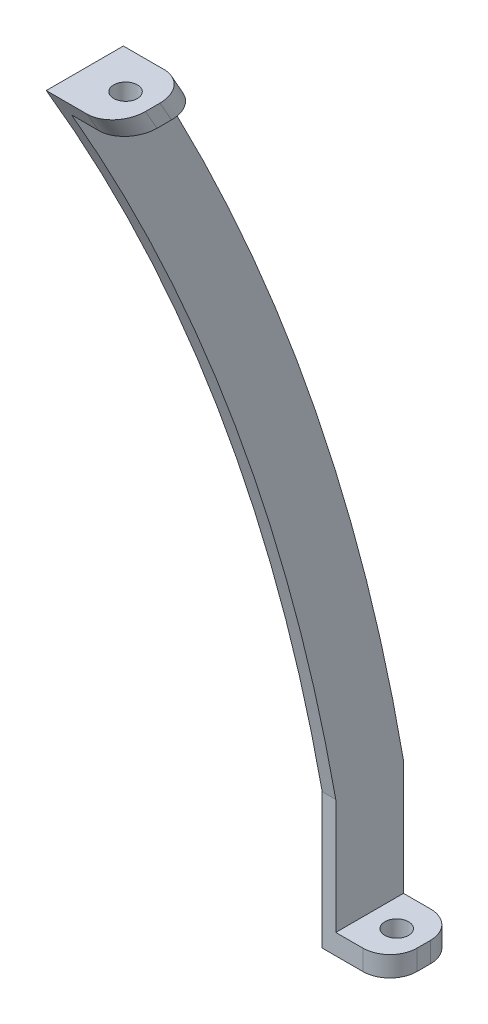
from build123d import *

# Parameters (mm, degrees)
BOSS_EXTRUDE1_DEPTH     = 2
SKETCH2_W               = 10
SKETCH2_H               = 3
BOSS_EXTRUDE2_DEPTH     = 8
FILLET1_R               = 4
CUT_EXTRUDE1_DEPTH      = 134.747858576
CUT_EXTRUDE1_DEPTH_BACK = 134.747858576
SKETCH3_R               = 1.75


with BuildPart() as part:
    # Sketch1 → Boss-Extrude1 (new body)
    with BuildSketch(Plane(origin=(0, 0, 0), x_dir=(0, 0, -1), z_dir=(1, 0, 0))):
        with BuildLine():
            Line((-40.736833925, 130), (-29.353634228, 130))
            ThreePointArc((-29.353634228, 130), (-4.909489029, 76.705560779), (10, 20))
            Line((10, 20), (10, 0))
            Line((10, 0), (0, 0))
            Line((0, 0), (0, 20))
            ThreePointArc((0, 20), (-15.436156632, 76.826587909), (-40.736833925, 130))
        make_face()
    extrude(amount=BOSS_EXTRUDE1_DEPTH)

    # Sketch2 → Boss-Extrude2 (add)
    with BuildSketch(Plane(origin=(2, 0, 0), x_dir=(0, 0, -1), z_dir=(1, 0, 0))):
        with Locations((5, 1.5)):
            Rectangle(SKETCH2_W, SKETCH2_H)
        with BuildLine():
            Line((-40.736833925, 130), (-29.353634228, 130))
            ThreePointArc((-29.353634228, 130), (-28.507977965, 128.502132743), (-27.669921848, 127))
            Line((-27.669921848, 127), (-38.985998837, 127))
            ThreePointArc((-38.985998837, 127), (-39.857464817, 128.502306179), (-40.736833925, 130))
        make_face()
    extrude(amount=BOSS_EXTRUDE2_DEPTH)

    # Fillet1
    fillet1_edges = [part.edges().sort_by_distance(p)[0] for p in [
        (10, 1.5, 0),
        (10, 1.5, -10),
        (10, 128.502306179, 39.857464817),
        (10, 128.502132743, 28.507977965),
    ]]
    fillet(fillet1_edges, radius=FILLET1_R)

    # Sketch3 → Cut-Extrude1 (cut, two sides: drawn at the far end of the back side and taken through both)
    with BuildSketch(Plane(origin=(0, 3, 0), x_dir=(1, 0, 0), z_dir=(0, 1, 0)).offset(-CUT_EXTRUDE1_DEPTH_BACK)):
        with Locations(Location((6, 5, 0), (0, 0, 270))):
            Circle(SKETCH3_R)
        with Locations(Location((6, -35.031677414, 0), (0, 0, 270))):
            Circle(SKETCH3_R)
    extrude(amount=CUT_EXTRUDE1_DEPTH + CUT_EXTRUDE1_DEPTH_BACK, mode=Mode.SUBTRACT)


solid = part.part
